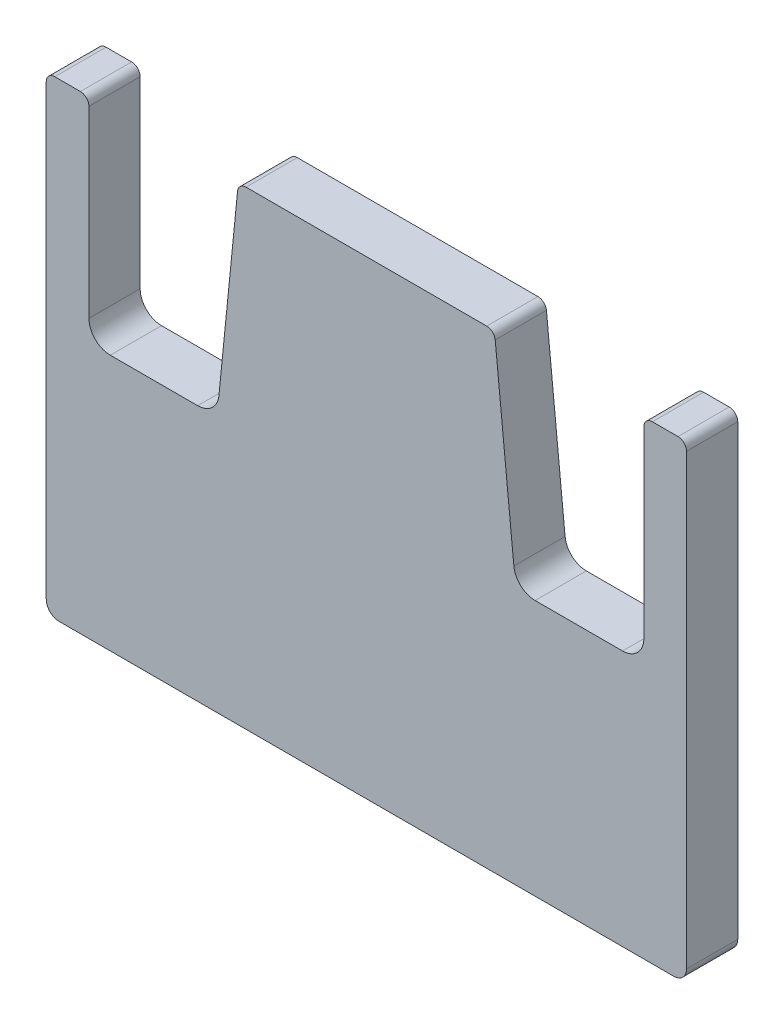
from build123d import *

# Parameters (mm, degrees)
ESQUISSE1_W                  = 150
ESQUISSE1_H                  = 110
BOSS_EXTRU_1_DEPTH           = 12
ENL_V_MAT_EXTRU_1_DEPTH      = 187.397424875
ENL_V_MAT_EXTRU_1_DEPTH_BACK = 187.397424875
CONG_1_R                     = 5
CONG_2_R                     = 2
CONG_3_R                     = 3


with BuildPart() as part:
    # Esquisse1 → Boss.-Extru.1 (new body)
    with BuildSketch(Plane.XY):
        with Locations((75, 55)):
            Rectangle(ESQUISSE1_W, ESQUISSE1_H)
    extrude(amount=BOSS_EXTRU_1_DEPTH)

    # Esquisse2 → Enlèv. mat.-Extru.1 (cut, two sides: drawn at the far end of the back side and taken through both)
    with BuildSketch(Plane.XY.offset(12).offset(-ENL_V_MAT_EXTRU_1_DEPTH_BACK)):
        Polygon((105, 110), (110, 60), (140, 60), (140, 110), align=None)
        Polygon((10, 110), (45, 110), (40, 60), (10, 60), align=None)
    extrude(amount=ENL_V_MAT_EXTRU_1_DEPTH + ENL_V_MAT_EXTRU_1_DEPTH_BACK, mode=Mode.SUBTRACT)

    # Congé1
    cong_1_edges = [part.edges().sort_by_distance(p)[0] for p in [
        (10, 60, 6),
        (40, 60, 6),
        (140, 60, 6),
        (110, 60, 6),
    ]]
    fillet(cong_1_edges, radius=CONG_1_R)

    # Congé2
    cong_2_edges = [part.edges().sort_by_distance(p)[0] for p in [
        (10, 110, 6),
        (45, 110, 6),
        (105, 110, 6),
        (140, 110, 6),
        (0, 110, 6),
        (150, 110, 6),
    ]]
    fillet(cong_2_edges, radius=CONG_2_R)

    # Congé3
    cong_3_edges = [part.edges().sort_by_distance(p)[0] for p in [
        (150, 0, 6),
        (0, 0, 6),
    ]]
    fillet(cong_3_edges, radius=CONG_3_R)


solid = part.part
